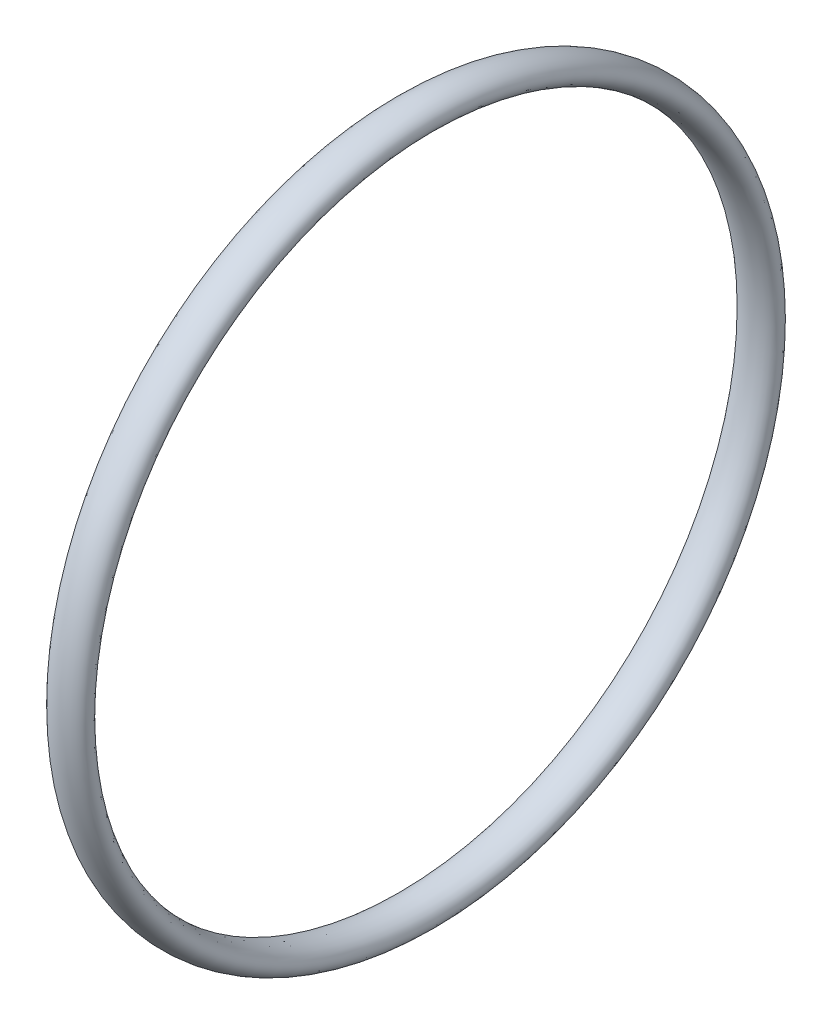
from build123d import *

# Parameters (mm, degrees)
SKETCH1_RX = 2
SKETCH1_RY = 1.25


with BuildPart() as part:
    # Sketch1 → Revolve1 (revolve)
    with BuildSketch(Plane(origin=(0, 0, 0), x_dir=(1, 0, 0), z_dir=(0, 1, 0))):
        with Locations(Location((0, 33.75), (0, 0, 180))):
            Ellipse(SKETCH1_RX, SKETCH1_RY)
    revolve(axis=Axis((-88.99, 0, 0), (1, 0, 0)))


solid = part.part
